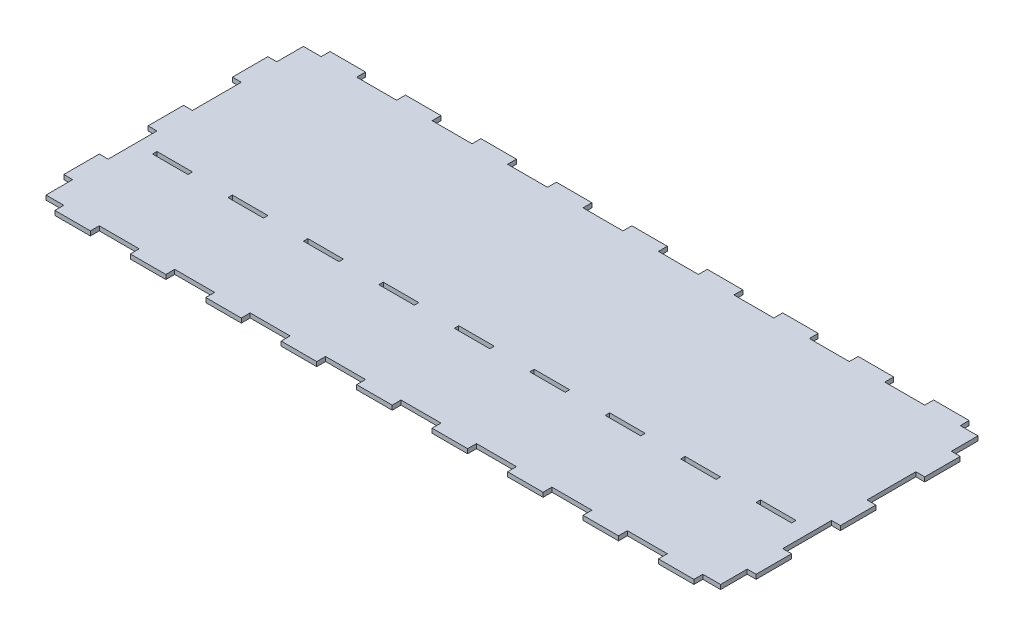
from build123d import *

# Parameters (mm, degrees)
SKETCH1_2_W         = 20
SKETCH1_2_H         = 2.5
BOSS_EXTRUDE2_DEPTH = 2.5


with BuildPart() as part:
    # Sketch1<2> → Boss-Extrude2 (new body)
    with BuildSketch(Plane(origin=(0, 0, 0), x_dir=(1, 0, 0), z_dir=(0, 1, 0))):
        Polygon((-190, -72.5), (-180, -72.5), (-180, -77.5), (-160, -77.5), (-160, -72.5), (-137.5, -72.5), (-137.5, -77.5), (-117.5, -77.5), (-117.5, -72.5), (-95, -72.5), (-95, -77.5), (-75, -77.5), (-75, -72.5), (-52.5, -72.5), (-52.5, -77.5), (-32.5, -77.5), (-32.5, -72.5), (-10, -72.5), (-10, -77.5), (10, -77.5), (10, -72.5), (32.5, -72.5), (32.5, -77.5), (52.5, -77.5), (52.5, -72.5), (75, -72.5), (75, -77.5), (95, -77.5), (95, -72.5), (117.5, -72.5), (117.5, -77.5), (137.5, -77.5), (137.5, -72.5), (160, -72.5), (160, -77.5), (180, -77.5), (180, -72.5), (190, -72.5), (190, -57.5), (195, -57.5), (195, -37.5), (190, -37.5), (190, -10), (195, -10), (195, 10), (190, 10), (190, 37.5), (195, 37.5), (195, 57.5), (190, 57.5), (190, 72.5), (180, 72.5), (180, 77.5), (160, 77.5), (160, 72.5), (137.5, 72.5), (137.5, 77.5), (117.5, 77.5), (117.5, 72.5), (95, 72.5), (95, 77.5), (75, 77.5), (75, 72.5), (52.5, 72.5), (52.5, 77.5), (32.5, 77.5), (32.5, 72.5), (10, 72.5), (10, 77.5), (-10, 77.5), (-10, 72.5), (-32.5, 72.5), (-32.5, 77.5), (-52.5, 77.5), (-52.5, 72.5), (-75, 72.5), (-75, 77.5), (-95, 77.5), (-95, 72.5), (-117.5, 72.5), (-117.5, 77.5), (-137.5, 77.5), (-137.5, 72.5), (-160, 72.5), (-160, 77.5), (-180, 77.5), (-180, 72.5), (-190, 72.5), (-190, 57.5), (-195, 57.5), (-195, 37.5), (-190, 37.5), (-190, 10), (-195, 10), (-195, -10), (-190, -10), (-190, -37.5), (-195, -37.5), (-195, -57.5), (-190, -57.5), align=None)
        with Locations((-170, -21.25)):
            Rectangle(SKETCH1_2_W, SKETCH1_2_H, mode=Mode.SUBTRACT)
        with Locations((-127.5, -21.25)):
            Rectangle(SKETCH1_2_W, SKETCH1_2_H, mode=Mode.SUBTRACT)
        with Locations((-85, -21.25)):
            Rectangle(SKETCH1_2_W, SKETCH1_2_H, mode=Mode.SUBTRACT)
        with Locations((-42.5, -21.25)):
            Rectangle(SKETCH1_2_W, SKETCH1_2_H, mode=Mode.SUBTRACT)
        with Locations((0, -21.25)):
            Rectangle(SKETCH1_2_W, SKETCH1_2_H, mode=Mode.SUBTRACT)
        with Locations((42.5, -21.25)):
            Rectangle(SKETCH1_2_W, SKETCH1_2_H, mode=Mode.SUBTRACT)
        with Locations((85, -21.25)):
            Rectangle(SKETCH1_2_W, SKETCH1_2_H, mode=Mode.SUBTRACT)
        with Locations((127.5, -21.25)):
            Rectangle(SKETCH1_2_W, SKETCH1_2_H, mode=Mode.SUBTRACT)
        with Locations((170, -21.25)):
            Rectangle(SKETCH1_2_W, SKETCH1_2_H, mode=Mode.SUBTRACT)
    extrude(amount=BOSS_EXTRUDE2_DEPTH)


solid = part.part
